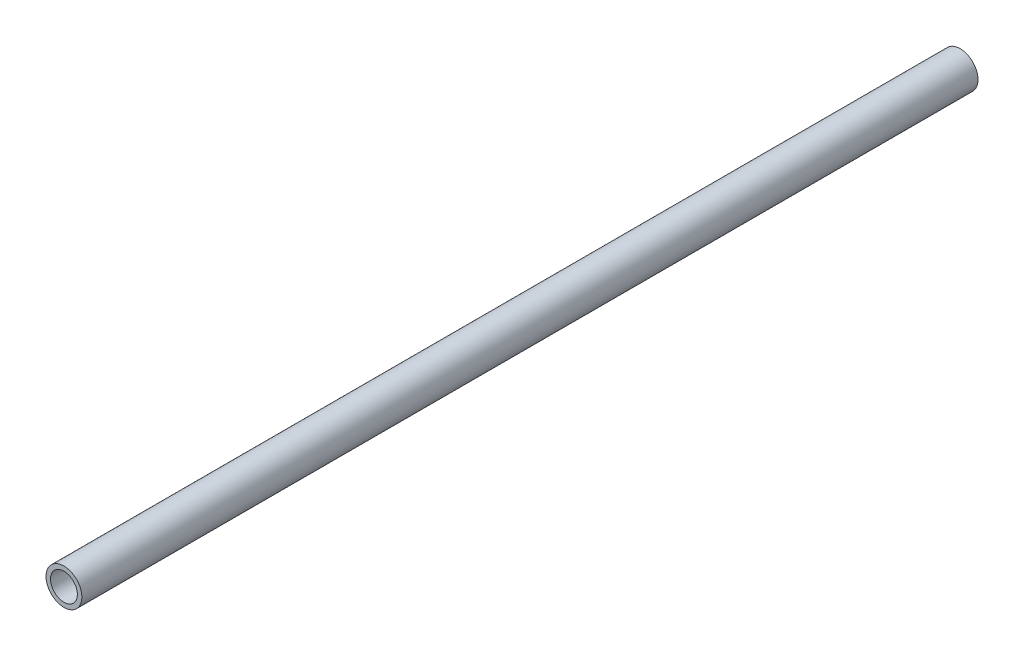
from build123d import *

# Parameters (mm, degrees)
SKETCH1_R           = 12.7
SKETCH1_R_2         = 9.525
BOSS_EXTRUDE1_DEPTH = 635


with BuildPart() as part:
    # Sketch1 → Boss-Extrude1 (new body)
    with BuildSketch(Plane.XY):
        with Locations(Location((0, 0, 0), (0, 0, 180))):
            Circle(SKETCH1_R)
        with Locations(Location((0, 0, 0), (0, 0, 180))):
            Circle(SKETCH1_R_2, mode=Mode.SUBTRACT)
    extrude(amount=BOSS_EXTRUDE1_DEPTH)


solid = part.part
